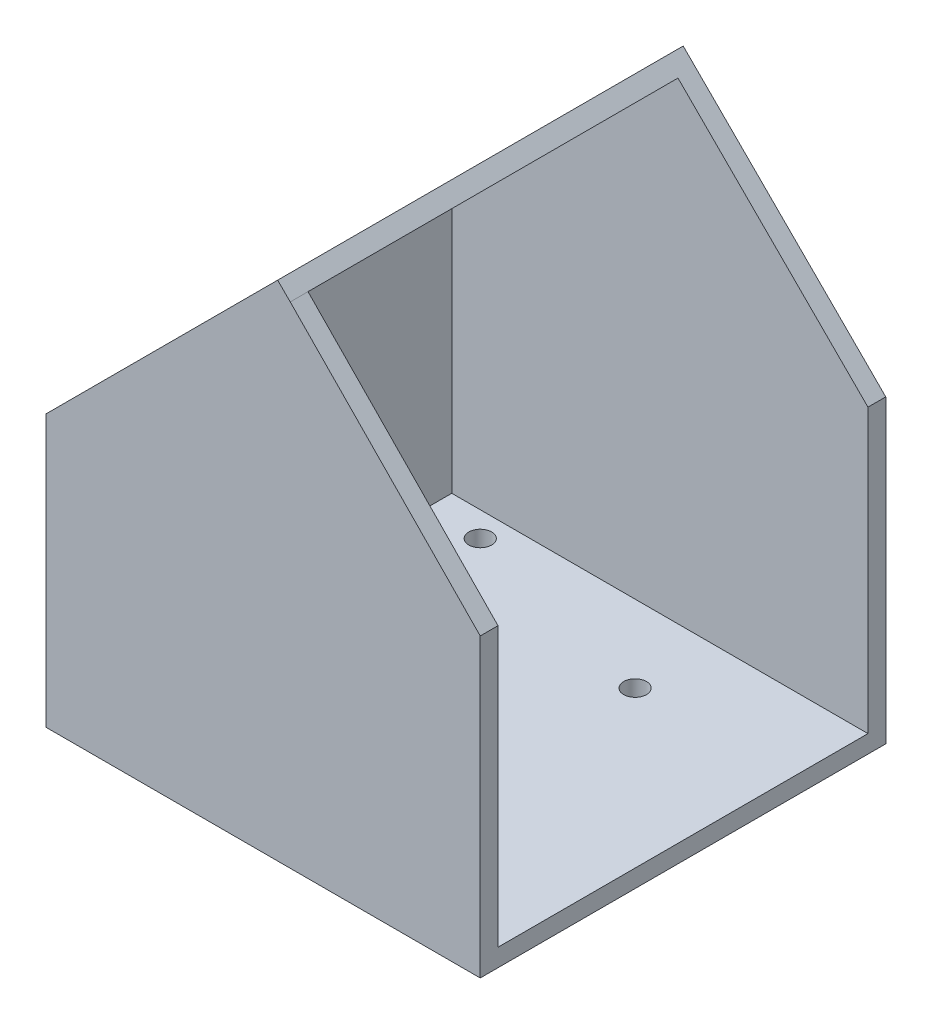
from build123d import *

# Parameters (mm, degrees)
EXTRUDE_1_DEPTH     = 52
EXTRUDE_2_DEPTH     = 2.5
EXTRUDE_3_DEPTH     = 2.5
SKETCH_4_R          = 1.6
SKETCH_4_R_2        = 12.5
CUT_EXTRUDE_1_DEPTH = 5
SKETCH_6_R          = 1.6
CUT_EXTRUDE_2_DEPTH = 5
CUT_EXTRUDE_3_DEPTH = 136.636948309


with BuildPart() as part:
    # 草图1 → 凸台-拉伸1 (new body)
    with BuildSketch(Plane.XY):
        Polygon((32.526911935, 70.711610456), (0, 38.184698521), (0, 0), (100.73852239, 0), (100.73852239, 2.5), (94.853312534, 2.5), (2.5, 2.5), (2.5, 37.149164615), (32.494813779, 67.143978395), (34.294678888, 68.943843503), align=None)
    extrude(amount=EXTRUDE_1_DEPTH)

    # 草图2 → 凸台-拉伸2 (add)
    with BuildSketch(Plane.XY.offset(52)):
        Polygon((32.526911935, 70.711610456), (0, 38.184698521), (0, 0), (100.73852239, 0), (100.73852239, 1), (34.294678888, 68.943843503), align=None)
    extrude(amount=EXTRUDE_2_DEPTH)

    # 草图3 → 凸台-拉伸3 (add)
    with BuildSketch(Plane(origin=(0, 0, 0), x_dir=(-1, 0, 0), z_dir=(0, 0, -1))):
        Polygon((-32.526911935, 70.711610456), (0, 38.184698521), (0, 0), (-100.73852239, 0), (-100.73852239, 2.5), (-34.294678888, 68.943843503), align=None)
    extrude(amount=EXTRUDE_3_DEPTH)

    # 草图4 → 切除-拉伸1 (cut)
    with BuildSketch(Plane(origin=(-19.092349261, 19.092349261, 0), x_dir=(0, 0, 1), z_dir=(-0.7071067811865468, 0.7071067811865483, 0))):
        with Locations(Location((10.5, 67.500659262, 0), (0, 0, 270))):
            Circle(SKETCH_4_R)
        with Locations(Location((41.5, 67.500659262, 0), (0, 0, 270))):
            Circle(SKETCH_4_R)
        with Locations(Location((10.5, 36.500659262, 0), (0, 0, 270))):
            Circle(SKETCH_4_R)
        with Locations(Location((41.5, 36.500659262, 0), (0, 0, 270))):
            Circle(SKETCH_4_R)
        with Locations(Location((26, 52.000659262, 0), (0, 0, 270))):
            Circle(SKETCH_4_R_2)
    extrude(amount=-CUT_EXTRUDE_1_DEPTH, mode=Mode.SUBTRACT)

    # 草图6 → 切除-拉伸2 (cut)
    with BuildSketch(Plane.XZ):
        with Locations(Location((10, 48.5, 0), (0, 0, 270))):
            Circle(SKETCH_6_R)
        with Locations(Location((10, 3.5, 0), (0, 0, 270))):
            Circle(SKETCH_6_R)
        with Locations(Location((39.092556486, 41.177216573, 0), (0, 0, 270))):
            Circle(SKETCH_6_R)
        with Locations(Location((39.092556486, 10.822783427, 0), (0, 0, 270))):
            Circle(SKETCH_6_R)
    extrude(amount=-CUT_EXTRUDE_2_DEPTH, mode=Mode.SUBTRACT)

    # 草图7 → 切除-拉伸3 (cut, through all)
    with BuildSketch(Plane.XY.offset(54.5)):
        Polygon((61, 42.23852239), (61, 0), (103.406412913, 0), (103.406412913, 12.738477269), align=None)
    extrude(amount=-CUT_EXTRUDE_3_DEPTH, mode=Mode.SUBTRACT)


solid = part.part
